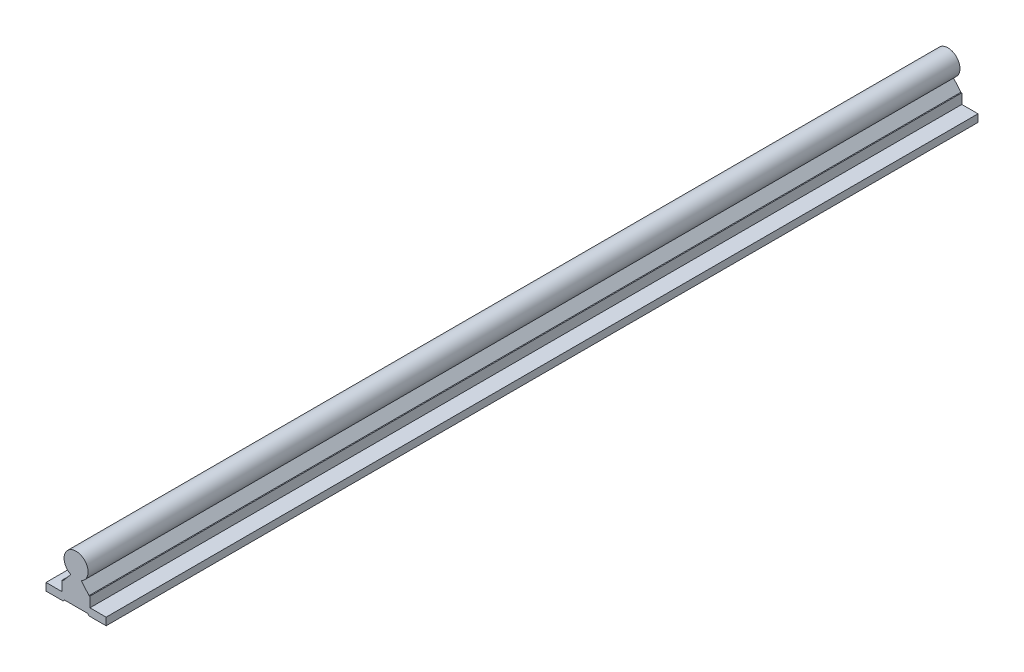
from build123d import *

# Parameters (mm, degrees)
DODANIE_WYCI_GNI_CIE1_DEPTH = 580


with BuildPart() as part:
    # Szkic1 → Dodanie-wyciągnięcie1 (new body)
    with BuildSketch(Plane.XY):
        with BuildLine():
            Line((-3.487119155, 17.8), (-8.605626905, 11.7))
            Line((-8.605626905, 11.7), (-9.25, 11.7))
            Line((-9.25, 11.7), (-9.25, 5))
            Line((-9.25, 5), (-20, 5))
            Line((-20, 5), (-20, 0))
            Line((-20, 0), (-8.605626905, 0))
            Line((-8.605626905, 0), (-7.766527274, 1))
            Line((-7.766527274, 1), (7.766527274, 1))
            Line((7.766527274, 1), (8.605626905, 0))
            Line((8.605626905, 0), (20, 0))
            Line((20, 0), (20, 5))
            Line((20, 5), (9.25, 5))
            Line((9.25, 5), (9.25, 11.7))
            Line((9.25, 11.7), (8.605626905, 11.7))
            Line((8.605626905, 11.7), (3.487119155, 17.8))
            ThreePointArc((3.487119155, 17.8), (0, 33), (-3.487119155, 17.8))
        make_face()
    extrude(amount=DODANIE_WYCI_GNI_CIE1_DEPTH)


solid = part.part
